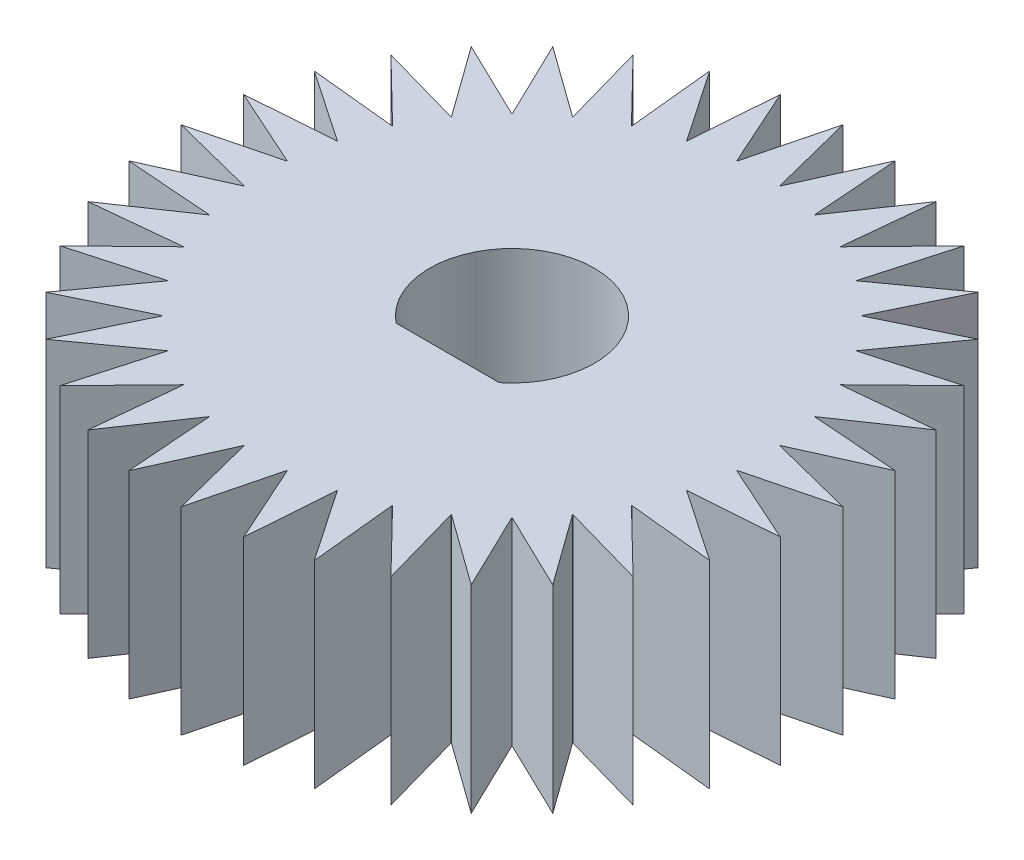
from build123d import *

# Parameters (mm, degrees)
EXTRUDE_2_DEPTH = 6


with BuildPart() as part:
    # Эскиз1 → Бобышка-Вытянуть2 (new body)
    with BuildSketch(Plane(origin=(0, 0, 0), x_dir=(1, 0, 0), z_dir=(0, 1, 0))):
        with BuildLine():
            Line((0, 10.03), (-0.649389435, 7.471833333))
            ThreePointArc((-0.649389435, 7.471833333), (-0.653668071, 7.471460236), (-0.657946491, 7.471084688))
            Line((-0.657946491, 7.471084688), (-1.741691222, 9.877621763))
            Line((-1.741691222, 9.877621763), (-1.936993993, 7.245554104))
            ThreePointArc((-1.936993993, 7.245554104), (-1.941142838, 7.244443697), (-1.945291047, 7.243330915))
            Line((-1.945291047, 7.243330915), (-3.430462038, 9.425116986))
            Line((-3.430462038, 9.425116986), (-3.165743968, 6.799122379))
            ThreePointArc((-3.165743968, 6.799122379), (-3.169636963, 6.797308403), (-3.173528919, 6.795492197))
            Line((-3.173528919, 6.795492197), (-5.015, 8.6862348))
            Line((-5.015, 8.6862348), (-4.298304415, 6.146102762))
            ThreePointArc((-4.298304415, 6.146102762), (-4.301823273, 6.143640332), (-4.30534072, 6.141175888))
            Line((-4.30534072, 6.141175888), (-6.447159725, 7.683425764))
            Line((-6.447159725, 7.683425764), (-5.300263057, 5.306336922))
            ThreePointArc((-5.300263057, 5.306336922), (-5.303300859, 5.303300859), (-5.306336922, 5.300263057))
            Line((-5.306336922, 5.300263057), (-7.683425764, 6.447159725))
            Line((-7.683425764, 6.447159725), (-6.141175888, 4.30534072))
            ThreePointArc((-6.141175888, 4.30534072), (-6.143640332, 4.301823273), (-6.146102762, 4.298304415))
            Line((-6.146102762, 4.298304415), (-8.6862348, 5.015))
            Line((-8.6862348, 5.015), (-6.795492197, 3.173528919))
            ThreePointArc((-6.795492197, 3.173528919), (-6.797308403, 3.169636963), (-6.799122379, 3.165743968))
            Line((-6.799122379, 3.165743968), (-9.425116986, 3.430462038))
            Line((-9.425116986, 3.430462038), (-7.243330915, 1.945291047))
            ThreePointArc((-7.243330915, 1.945291047), (-7.244443697, 1.941142838), (-7.245554104, 1.936993993))
            Line((-7.245554104, 1.936993993), (-9.877621763, 1.741691222))
            Line((-9.877621763, 1.741691222), (-7.471084688, 0.657946491))
            ThreePointArc((-7.471084688, 0.657946491), (-7.471460236, 0.653668071), (-7.471833333, 0.649389435))
            Line((-7.471833333, 0.649389435), (-10.03, 0))
            Line((-10.03, 0), (-7.471833333, -0.649389435))
            ThreePointArc((-7.471833333, -0.649389435), (-7.471460236, -0.653668071), (-7.471084688, -0.657946491))
            Line((-7.471084688, -0.657946491), (-9.877621763, -1.741691222))
            Line((-9.877621763, -1.741691222), (-7.245554104, -1.936993993))
            ThreePointArc((-7.245554104, -1.936993993), (-7.244443697, -1.941142838), (-7.243330915, -1.945291047))
            Line((-7.243330915, -1.945291047), (-9.425116986, -3.430462038))
            Line((-9.425116986, -3.430462038), (-6.799122379, -3.165743968))
            ThreePointArc((-6.799122379, -3.165743968), (-6.797308403, -3.169636963), (-6.795492197, -3.173528919))
            Line((-6.795492197, -3.173528919), (-8.6862348, -5.015))
            Line((-8.6862348, -5.015), (-6.146102762, -4.298304415))
            ThreePointArc((-6.146102762, -4.298304415), (-6.143640332, -4.301823273), (-6.141175888, -4.30534072))
            Line((-6.141175888, -4.30534072), (-7.683425764, -6.447159725))
            Line((-7.683425764, -6.447159725), (-5.306336922, -5.300263057))
            ThreePointArc((-5.306336922, -5.300263057), (-5.303300859, -5.303300859), (-5.300263057, -5.306336922))
            Line((-5.300263057, -5.306336922), (-6.447159725, -7.683425764))
            Line((-6.447159725, -7.683425764), (-4.30534072, -6.141175888))
            ThreePointArc((-4.30534072, -6.141175888), (-4.301823273, -6.143640332), (-4.298304415, -6.146102762))
            Line((-4.298304415, -6.146102762), (-5.015, -8.6862348))
            Line((-5.015, -8.6862348), (-3.173528919, -6.795492197))
            ThreePointArc((-3.173528919, -6.795492197), (-3.169636963, -6.797308403), (-3.165743968, -6.799122379))
            Line((-3.165743968, -6.799122379), (-3.430462038, -9.425116986))
            Line((-3.430462038, -9.425116986), (-1.945291047, -7.243330915))
            ThreePointArc((-1.945291047, -7.243330915), (-1.941142838, -7.244443697), (-1.936993993, -7.245554104))
            Line((-1.936993993, -7.245554104), (-1.741691222, -9.877621763))
            Line((-1.741691222, -9.877621763), (-0.657946491, -7.471084688))
            ThreePointArc((-0.657946491, -7.471084688), (-0.653668071, -7.471460236), (-0.649389435, -7.471833333))
            Line((-0.649389435, -7.471833333), (0, -10.03))
            Line((0, -10.03), (0.649389435, -7.471833333))
            ThreePointArc((0.649389435, -7.471833333), (0.653668071, -7.471460236), (0.657946491, -7.471084688))
            Line((0.657946491, -7.471084688), (1.741691222, -9.877621763))
            Line((1.741691222, -9.877621763), (1.936993993, -7.245554104))
            ThreePointArc((1.936993993, -7.245554104), (1.941142838, -7.244443697), (1.945291047, -7.243330915))
            Line((1.945291047, -7.243330915), (3.430462038, -9.425116986))
            Line((3.430462038, -9.425116986), (3.165743968, -6.799122379))
            ThreePointArc((3.165743968, -6.799122379), (3.169636963, -6.797308403), (3.173528919, -6.795492197))
            Line((3.173528919, -6.795492197), (5.015, -8.6862348))
            Line((5.015, -8.6862348), (4.298304415, -6.146102762))
            ThreePointArc((4.298304415, -6.146102762), (4.301823273, -6.143640332), (4.30534072, -6.141175888))
            Line((4.30534072, -6.141175888), (6.447159725, -7.683425764))
            Line((6.447159725, -7.683425764), (5.300263057, -5.306336922))
            ThreePointArc((5.300263057, -5.306336922), (5.303300859, -5.303300859), (5.306336922, -5.300263057))
            Line((5.306336922, -5.300263057), (7.683425764, -6.447159725))
            Line((7.683425764, -6.447159725), (6.141175888, -4.30534072))
            ThreePointArc((6.141175888, -4.30534072), (6.143640332, -4.301823273), (6.146102762, -4.298304415))
            Line((6.146102762, -4.298304415), (8.6862348, -5.015))
            Line((8.6862348, -5.015), (6.795492197, -3.173528919))
            ThreePointArc((6.795492197, -3.173528919), (6.797308403, -3.169636963), (6.799122379, -3.165743968))
            Line((6.799122379, -3.165743968), (9.425116986, -3.430462038))
            Line((9.425116986, -3.430462038), (7.243330915, -1.945291047))
            ThreePointArc((7.243330915, -1.945291047), (7.244443697, -1.941142838), (7.245554104, -1.936993993))
            Line((7.245554104, -1.936993993), (9.877621763, -1.741691222))
            Line((9.877621763, -1.741691222), (7.471084688, -0.657946491))
            ThreePointArc((7.471084688, -0.657946491), (7.471460236, -0.653668071), (7.471833333, -0.649389435))
            Line((7.471833333, -0.649389435), (10.03, 0))
            Line((10.03, 0), (7.471833333, 0.649389435))
            ThreePointArc((7.471833333, 0.649389435), (7.471460236, 0.653668071), (7.471084688, 0.657946491))
            Line((7.471084688, 0.657946491), (9.877621763, 1.741691222))
            Line((9.877621763, 1.741691222), (7.245554104, 1.936993993))
            ThreePointArc((7.245554104, 1.936993993), (7.244443697, 1.941142838), (7.243330915, 1.945291047))
            Line((7.243330915, 1.945291047), (9.425116986, 3.430462038))
            Line((9.425116986, 3.430462038), (6.799122379, 3.165743968))
            ThreePointArc((6.799122379, 3.165743968), (6.797308403, 3.169636963), (6.795492197, 3.173528919))
            Line((6.795492197, 3.173528919), (8.6862348, 5.015))
            Line((8.6862348, 5.015), (6.146102762, 4.298304415))
            ThreePointArc((6.146102762, 4.298304415), (6.143640332, 4.301823273), (6.141175888, 4.30534072))
            Line((6.141175888, 4.30534072), (7.683425764, 6.447159725))
            Line((7.683425764, 6.447159725), (5.306336922, 5.300263057))
            ThreePointArc((5.306336922, 5.300263057), (5.303300859, 5.303300859), (5.300263057, 5.306336922))
            Line((5.300263057, 5.306336922), (6.447159725, 7.683425764))
            Line((6.447159725, 7.683425764), (4.30534072, 6.141175888))
            ThreePointArc((4.30534072, 6.141175888), (4.301823273, 6.143640332), (4.298304415, 6.146102762))
            Line((4.298304415, 6.146102762), (5.015, 8.6862348))
            Line((5.015, 8.6862348), (3.173528919, 6.795492197))
            ThreePointArc((3.173528919, 6.795492197), (3.169636963, 6.797308403), (3.165743968, 6.799122379))
            Line((3.165743968, 6.799122379), (3.430462038, 9.425116986))
            Line((3.430462038, 9.425116986), (1.945291047, 7.243330915))
            ThreePointArc((1.945291047, 7.243330915), (1.941142838, 7.244443697), (1.936993993, 7.245554104))
            Line((1.936993993, 7.245554104), (1.741691222, 9.877621763))
            Line((1.741691222, 9.877621763), (0.657946491, 7.471084688))
            ThreePointArc((0.657946491, 7.471084688), (0.653668071, 7.471460236), (0.649389435, 7.471833333))
            Line((0.649389435, 7.471833333), (0, 10.03))
        make_face()
        with BuildLine():
            ThreePointArc((-1.564448785, -1.95), (0, 2.5), (1.564448785, -1.95))
            Line((1.564448785, -1.95), (-1.564448785, -1.95))
        make_face(mode=Mode.SUBTRACT)
    extrude(amount=EXTRUDE_2_DEPTH)


solid = part.part
